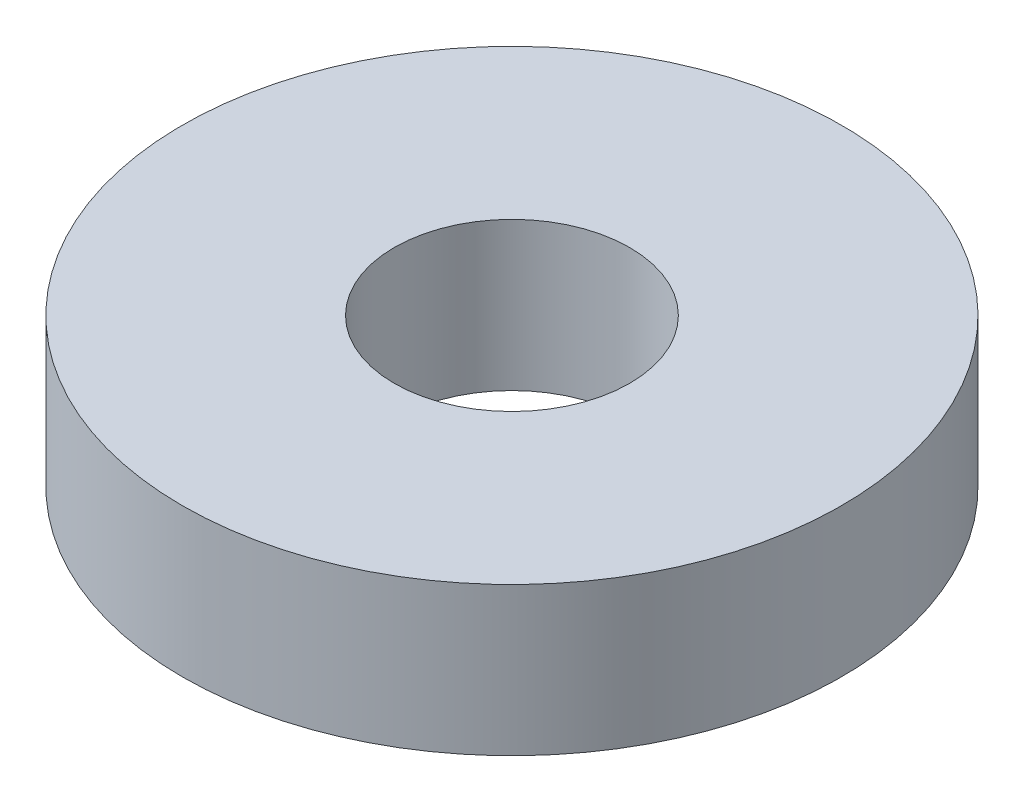
from build123d import *

# Parameters (mm, degrees)
SKETCH1_R           = 6.6675
SKETCH1_R_2         = 2.38125
BOSS_EXTRUDE1_DEPTH = 3


with BuildPart() as part:
    # Sketch1 → Boss-Extrude1 (new body)
    with BuildSketch(Plane(origin=(0, 0, 0), x_dir=(1, 0, 0), z_dir=(0, 1, 0))):
        with Locations(Location((0, 0, 0), (0, 0, 270))):
            Circle(SKETCH1_R)
        with Locations(Location((0, 0, 0), (0, 0, 270))):
            Circle(SKETCH1_R_2, mode=Mode.SUBTRACT)
    extrude(amount=BOSS_EXTRUDE1_DEPTH)


solid = part.part
